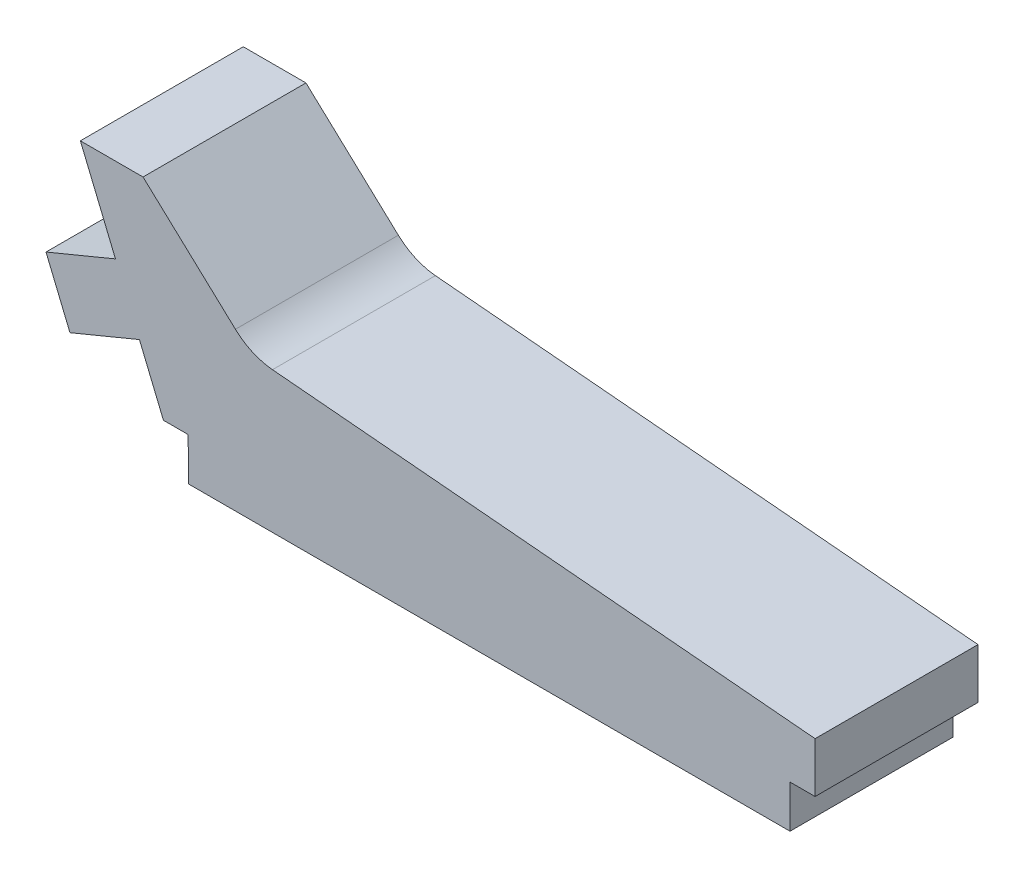
from build123d import *

# Parameters (mm, degrees)
SKETCH1_W      = 203.2
SKETCH1_H      = 101.6
EXTRUDE1_DEPTH = 50.8
EXTRUDE2_DEPTH = 16.51
SKETCH22_W     = 203.2
SKETCH22_H     = 50.8
EXTRUDE3_DEPTH = 12700


with BuildPart() as part:
    # Sketch1 → Extrude1 (new body)
    with BuildSketch(Plane.XY):
        with Locations((101.6, 50.8)):
            Rectangle(SKETCH1_W, SKETCH1_H)
    extrude(amount=EXTRUDE1_DEPTH)

    # Sketch20 → Extrude2 (add)
    with BuildSketch(Plane.XY.offset(50.8)):
        with BuildLine():
            ThreePointArc((98.73765298, 90.37654578), (100.476619995, 89.229944151), (102.493050685, 88.707728828))
            Line((102.493050685, 88.707728828), (157.48, 83.82))
            Line((157.48, 83.82), (157.48, 78.74))
            Line((157.48, 78.74), (154.94, 78.74))
            Line((154.94, 78.74), (154.94, 74.422))
            Line((154.94, 74.422), (93.98, 74.422))
            Line((93.98, 74.422), (93.947422963, 78.74))
            Line((93.947422963, 78.74), (91.44, 78.74))
            Line((91.44, 78.74), (89.009960204, 84.606635031))
            Line((89.009960204, 84.606635031), (81.969998167, 81.690587277))
            Line((81.969998167, 81.690587277), (79.539958371, 87.557222308))
            Line((79.539958371, 87.557222308), (86.579920409, 90.473270063))
            Line((86.579920409, 90.473270063), (83.023180413, 99.06))
            Line((83.023180413, 99.06), (89.373180413, 99.06))
            Line((89.373180413, 99.06), (98.73765298, 90.37654578))
        make_face()
    extrude(amount=EXTRUDE2_DEPTH)

    # Sketch22 → Extrude3 (cut)
    with BuildSketch(Plane(origin=(0, 101.6, 0), x_dir=(1, 0, 0), z_dir=(0, 1, 0))):
        with Locations((101.6, -25.4)):
            Rectangle(SKETCH22_W, SKETCH22_H)
    extrude(amount=-EXTRUDE3_DEPTH, mode=Mode.SUBTRACT)


solid = part.part
